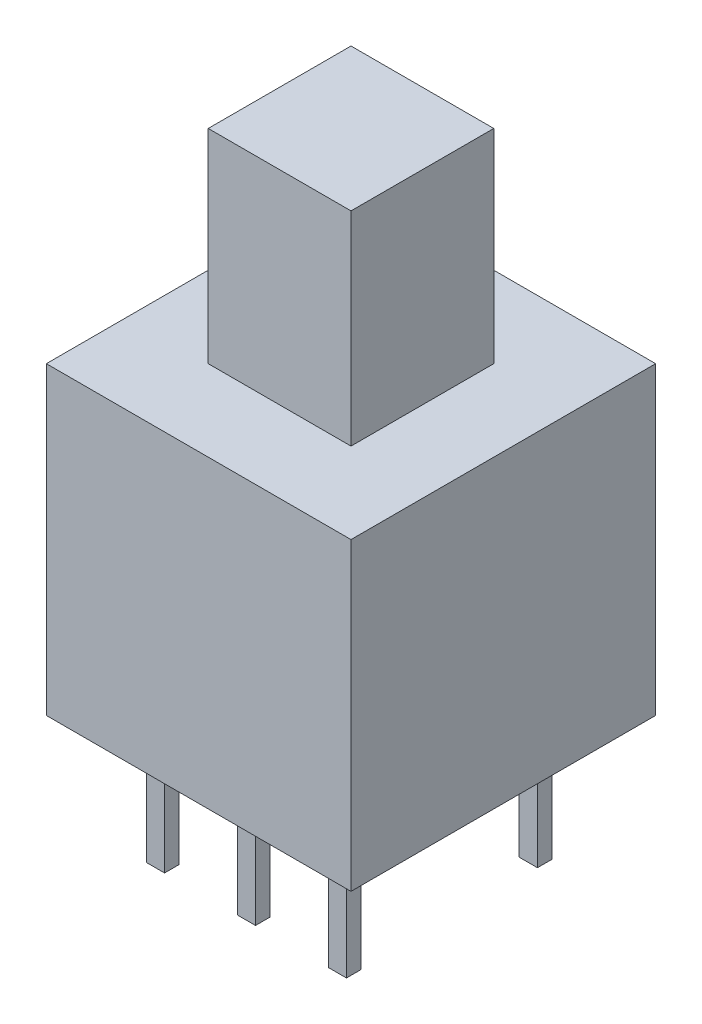
from build123d import *

# Parameters (mm, degrees)
SKETCH1_W           = 8.509
SKETCH1_H           = 8.509
BOSS_EXTRUDE1_DEPTH = 8.509
SKETCH2_W           = 3.9878
SKETCH2_H           = 3.9878
BOSS_EXTRUDE2_DEPTH = 5.6896
SKETCH3_W           = 0.508
SKETCH3_H           = 0.4064
BOSS_EXTRUDE3_DEPTH = 3.5052


with BuildPart() as part:
    # Sketch1 → Boss-Extrude1 (new body)
    with BuildSketch(Plane(origin=(0, 0, 0), x_dir=(1, 0, 0), z_dir=(0, 1, 0))):
        with Locations((4.2545, 4.2545)):
            Rectangle(SKETCH1_W, SKETCH1_H)
    extrude(amount=BOSS_EXTRUDE1_DEPTH)

    # Sketch2 → Boss-Extrude2 (add)
    with BuildSketch(Plane(origin=(0, 8.509, 0), x_dir=(1, 0, 0), z_dir=(0, 1, 0))):
        with Locations((4.2545, 4.2545)):
            Rectangle(SKETCH2_W, SKETCH2_H)
    extrude(amount=BOSS_EXTRUDE2_DEPTH)

    # Sketch3 → Boss-Extrude3 (add)
    with BuildSketch(Plane.XZ):
        with Locations((1.7018, -1.5494)):
            Rectangle(SKETCH3_W, SKETCH3_H)
        with Locations((1.7018, -6.8834)):
            Rectangle(SKETCH3_W, SKETCH3_H)
        with Locations((4.2418, -6.8834)):
            Rectangle(SKETCH3_W, SKETCH3_H)
        with Locations((6.7818, -6.8834)):
            Rectangle(SKETCH3_W, SKETCH3_H)
        with Locations((4.2418, -1.5494)):
            Rectangle(SKETCH3_W, SKETCH3_H)
        with Locations((6.7818, -1.5494)):
            Rectangle(SKETCH3_W, SKETCH3_H)
    extrude(amount=BOSS_EXTRUDE3_DEPTH)


solid = part.part
